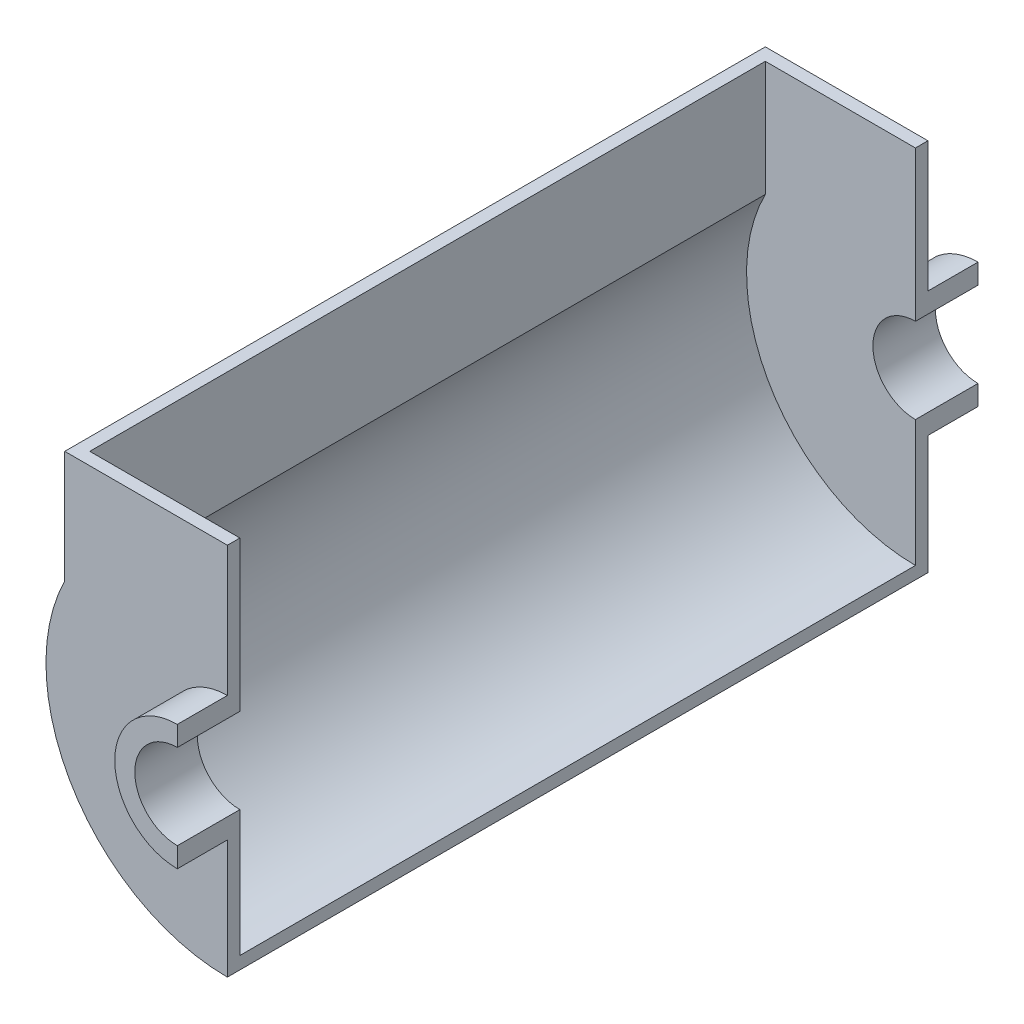
from build123d import *

# Parameters (mm, degrees)
BOSS_EXTRUDE1_DEPTH      = 20
BOSS_EXTRUDE1_DEPTH_BACK = 5
BOSS_EXTRUDE2_START      = -5
BOSS_EXTRUDE2_DEPTH      = 5
BOSS_EXTRUDE3_START      = 135
BOSS_EXTRUDE3_DEPTH      = 135


with BuildPart() as part:
    # Sketch1 → Boss-Extrude1 (new, two sides: drawn at the far end of the back side and taken through both)
    with BuildSketch(Plane.XY.offset(-BOSS_EXTRUDE1_DEPTH_BACK)):
        with BuildLine():
            Line((0, 25), (0, 17))
            ThreePointArc((0, 17), (-17, 0), (0, -17))
            Line((0, -17), (0, -25))
            ThreePointArc((0, -25), (-25, 0), (0, 25))
        make_face()
    extrude(amount=BOSS_EXTRUDE1_DEPTH + BOSS_EXTRUDE1_DEPTH_BACK)

    # Sketch2 → Boss-Extrude2 (add)
    with BuildSketch(Plane.XY.offset(BOSS_EXTRUDE2_START)):
        with BuildLine():
            Line((0, 25), (0, 77))
            Line((0, 77), (-65, 77))
            Line((-65, 77), (-65, 32.113081447))
            ThreePointArc((-65, 32.113081447), (-61.581037686, -38.262590053), (0, -72.5))
            Line((0, -72.5), (0, -25))
            ThreePointArc((0, -25), (-25, 0), (0, 25))
        make_face()
    extrude(amount=BOSS_EXTRUDE2_DEPTH)

    # Sketch3 → Boss-Extrude3 (add)
    with BuildSketch(Plane(origin=(0, 0, -5), x_dir=(-1, 0, 0), z_dir=(0, 0, -1)).offset(BOSS_EXTRUDE3_START)):
        with BuildLine():
            Line((60, 30.923292192), (60, 77))
            Line((60, 77), (65, 77))
            Line((65, 77), (65, 32.113081447))
            ThreePointArc((65, 32.113081447), (61.581037686, -38.262590053), (0, -72.5))
            Line((0, -72.5), (0, -67.5))
            ThreePointArc((0, -67.5), (57.634938288, -35.134938288), (60, 30.923292192))
        make_face()
    extrude(amount=-BOSS_EXTRUDE3_DEPTH)

    # Mirror5: part across plane


with BuildPart() as part_1:
    add(part.part)
    add(part.part.mirror(Plane.XY.offset(-140)))


solid = part_1.part
